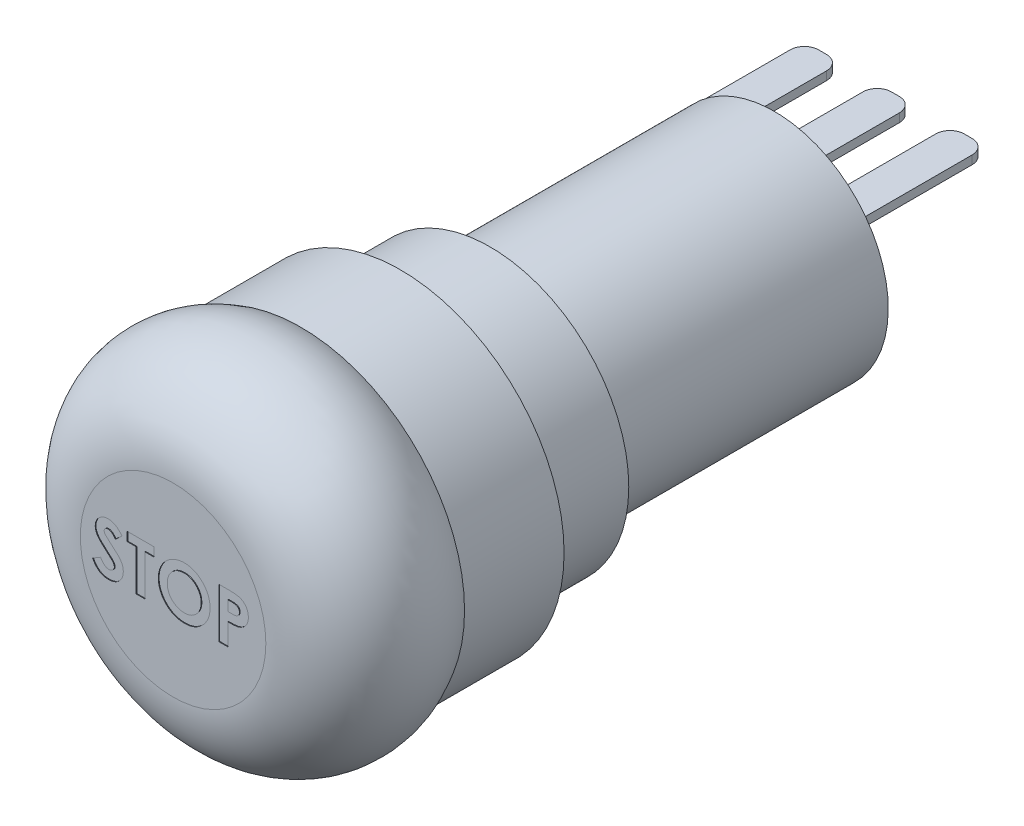
from build123d import *

# Parameters (mm, degrees)
ESQUISSE1_R             = 8
BOSS_EXTRU_1_DEPTH      = 20
ESQUISSE2_R             = 9.75
BOSS_EXTRU_2_DEPTH      = 6.3
ESQUISSE4_W             = 12.8
ESQUISSE4_H             = 0.6
BOSS_EXTRU_3_DEPTH      = 8.5
ENL_V_MAT_EXTRU_1_DEPTH = 0.05
ESQUISSE6_W             = 2.56
ESQUISSE6_H             = 8.5
ENL_V_MAT_EXTRU_2_DEPTH = 48.102123246
CONG_1_R                = 1


with BuildPart() as part:
    # Esquisse1 → Boss.-Extru.1 (new body)
    with BuildSketch(Plane.XY):
        Circle(ESQUISSE1_R)
    extrude(amount=BOSS_EXTRU_1_DEPTH)

    # Esquisse2 → Boss.-Extru.2 (add)
    with BuildSketch(Plane.XY.offset(20)):
        Circle(ESQUISSE2_R)
    extrude(amount=BOSS_EXTRU_2_DEPTH)

    # Esquisse3 → Révolution1 (revolve)
    with BuildSketch(Plane(origin=(0, 0, 0), x_dir=(1, 0, 0), z_dir=(0, 1, 0)), mode=Mode.PRIVATE) as r_volution1_sk:
        with BuildLine():
            Line((0, -26.3), (-11.5, -26.3))
            Line((-11.5, -26.3), (-11.5, -33.3))
            ThreePointArc((-11.5, -33.3), (-11.666697285, -39.267225633), (-6.524922359, -42.3))
            Line((-6.524922359, -42.3), (0, -42.3))
            Line((0, -42.3), (0, -26.3))
        make_face()
    revolve(r_volution1_sk.sketch.rotate(Axis((0, 0, 20), (0, 0, -1)), 180), axis=Axis((0, 0, 20), (0, 0, -1)))

    # Esquisse4 → Boss.-Extru.3 (add)
    with BuildSketch(Plane(origin=(0, 0, 0), x_dir=(-1, 0, 0), z_dir=(0, 0, -1))):
        with Locations((0, 4.5)):
            Rectangle(ESQUISSE4_W, ESQUISSE4_H)
    extrude(amount=BOSS_EXTRU_3_DEPTH)

    # Esquisse5 → Enlèv. mat.-Extru.1 (cut)
    # profile 1 of 4: a face of its own
    with BuildSketch(Plane.XY.offset(42.3)):
        with BuildLine():
            Line((-3.591313424, 1.492585178), (-4.061065026, 1.062797518))
            add(Edge.make_bspline(
                [(-4.061065026, 1.062797518), (-4.08118717, 1.091181894), (-4.119818882, 1.145675939), (-4.182436856, 1.21864475), (-4.244772078, 1.280892575), (-4.307402046, 1.332159373), (-4.370881887, 1.372133659), (-4.435101411, 1.400435896), (-4.499696539, 1.418427896), (-4.543094493, 1.420668333), (-4.564470475, 1.421771877)],
                knots=[0, 0, 0, 0, 1.299362458, 2.494594718, 3.587462134, 4.587049575, 5.512617175, 6.380583204, 7.202344345, 8, 8, 8, 8], degree=3))
            add(Edge.make_bspline(
                [(-4.564470475, 1.421771877), (-4.584409377, 1.421072621), (-4.62290616, 1.419722542), (-4.677786179, 1.406302853), (-4.726509442, 1.38314244), (-4.769028396, 1.352858253), (-4.802709681, 1.316372828), (-4.829601575, 1.278108998), (-4.844743971, 1.235874384), (-4.846737008, 1.206865947), (-4.84772368, 1.19250505)],
                knots=[0, 0, 0, 0, 1.185010067, 2.2879431, 3.333075148, 4.379039566, 5.372662701, 6.27520591, 7.14612461, 8, 8, 8, 8], degree=3))
            add(Edge.make_bspline(
                [(-4.84772368, 1.19250505), (-4.847105383, 1.177937062), (-4.845860218, 1.14859916), (-4.833833624, 1.10560081), (-4.815706113, 1.063586417), (-4.798384537, 1.038010257), (-4.789530571, 1.024936941)],
                knots=[0, 0, 0, 0, 0.967525499, 1.948461899, 2.951351359, 4, 4, 4, 4], degree=3))
            add(Edge.make_bspline(
                [(-4.789530571, 1.024936941), (-4.781481358, 1.014775189), (-4.762953134, 0.991384179), (-4.727623605, 0.954336465), (-4.683257136, 0.908949772), (-4.628146412, 0.856784816), (-4.564579232, 0.795965541), (-4.489609173, 0.728882776), (-4.405394202, 0.653459046), (-4.345536151, 0.600936691), (-4.314169994, 0.573414505)],
                knots=[0, 0, 0, 0, 0.473873513, 1.090794244, 1.870441696, 2.795289791, 3.865433203, 5.087734844, 6.473946851, 8, 8, 8, 8], degree=3))
            add(Edge.make_bspline(
                [(-4.314169994, 0.573414505), (-4.284728344, 0.547934242), (-4.228854208, 0.499577995), (-4.149356408, 0.430944068), (-4.079491082, 0.369195797), (-4.018240452, 0.315259892), (-3.966533017, 0.268570441), (-3.9241514, 0.22890427), (-3.89057798, 0.197033607), (-3.871493457, 0.177783706), (-3.86334868, 0.169568351)],
                knots=[0, 0, 0, 0, 1.543621617, 2.929473131, 4.163658386, 5.240097082, 6.164993805, 6.925417477, 7.541396219, 8, 8, 8, 8], degree=3))
            add(Edge.make_bspline(
                [(-3.86334868, 0.169568351), (-3.832449095, 0.136128383), (-3.773049243, 0.071845021), (-3.695850374, -0.027773974), (-3.632313208, -0.125022426), (-3.583159651, -0.221730222), (-3.546036908, -0.319292663), (-3.519864883, -0.420102463), (-3.504190282, -0.525213021), (-3.502450036, -0.596938145), (-3.501569834, -0.633216104)],
                knots=[0, 0, 0, 0, 1.206664779, 2.319633467, 3.337109185, 4.282041471, 5.190008762, 6.099243693, 7.03861361, 8, 8, 8, 8], degree=3))
            add(Edge.make_bspline(
                [(-3.501569834, -0.633216104), (-3.502196339, -0.668564525), (-3.503425566, -0.737919444), (-3.518481233, -0.839410036), (-3.539949732, -0.936540938), (-3.573143796, -1.028255227), (-3.613600526, -1.116058366), (-3.66431888, -1.198582662), (-3.723880631, -1.276663293), (-3.792147544, -1.348904473), (-3.867658856, -1.414458337), (-3.948651915, -1.472815935), (-4.035918711, -1.520997565), (-4.12871365, -1.560671701), (-4.226987063, -1.591229251), (-4.330621875, -1.613814128), (-4.439776602, -1.627369215), (-4.514418178, -1.628786239), (-4.552551404, -1.629510174)],
                knots=[0, 0, 0, 0, 1.043214005, 2.046824704, 3.02475056, 3.976699089, 4.921714032, 5.875962561, 6.831408892, 7.817874052, 8.806269674, 9.781291748, 10.760897367, 11.74438705, 12.757449933, 13.795994037, 14.874007457, 16, 16, 16, 16], degree=3))
            add(Edge.make_bspline(
                [(-4.552551404, -1.629510174), (-4.582485662, -1.628979121), (-4.64177266, -1.62792733), (-4.729152731, -1.619340333), (-4.813528068, -1.605481834), (-4.894803629, -1.585618465), (-4.973345574, -1.560448883), (-5.04915713, -1.529705202), (-5.121714944, -1.492910907), (-5.191568023, -1.450822635), (-5.258376795, -1.401952607), (-5.32298603, -1.347299956), (-5.384753968, -1.286024098), (-5.443977268, -1.218269949), (-5.500277002, -1.143845645), (-5.555496064, -1.063787682), (-5.607180352, -0.976610294), (-5.639108036, -0.915454651), (-5.655415988, -0.884217706)],
                knots=[0, 0, 0, 0, 1.016823716, 2.013894106, 2.979844003, 3.91962641, 4.853723003, 5.779685073, 6.695824784, 7.614987388, 8.547259901, 9.504950863, 10.487499108, 11.500346958, 12.559593716, 13.656357062, 14.802919212, 16, 16, 16, 16], degree=3))
            Line((-5.655415988, -0.884217706), (-5.102932013, -0.552587098))
            add(Edge.make_bspline(
                [(-5.102932013, -0.552587098), (-5.082533203, -0.588045111), (-5.043426939, -0.656021154), (-4.97715772, -0.747355583), (-4.909268288, -0.825568403), (-4.838189101, -0.889277197), (-4.764784454, -0.939333834), (-4.688699786, -0.975107779), (-4.609881642, -0.997251811), (-4.556194303, -0.999956109), (-4.529414385, -1.001305046)],
                knots=[0, 0, 0, 0, 1.283663364, 2.460892379, 3.537111102, 4.529833553, 5.449777664, 6.316464042, 7.160231139, 8, 8, 8, 8], degree=3))
            add(Edge.make_bspline(
                [(-4.529414385, -1.001305046), (-4.502175374, -1.000203431), (-4.449327726, -0.998066136), (-4.37389447, -0.978324589), (-4.304734406, -0.947328912), (-4.244952956, -0.903102354), (-4.194333794, -0.852058185), (-4.156973947, -0.795269213), (-4.133504239, -0.733824917), (-4.131022922, -0.691141666), (-4.129774962, -0.669674437)],
                knots=[0, 0, 0, 0, 1.13588714, 2.203786484, 3.234766741, 4.283437687, 5.291419208, 6.222934724, 7.106237994, 8, 8, 8, 8], degree=3))
            add(Edge.make_bspline(
                [(-4.129774962, -0.669674437), (-4.130927402, -0.649702674), (-4.133268474, -0.609131949), (-4.15051209, -0.548809804), (-4.177469121, -0.488515093), (-4.20936119, -0.43905974), (-4.241815363, -0.397652113), (-4.272848873, -0.361774277), (-4.310639479, -0.32213555), (-4.35509136, -0.278686069), (-4.405617191, -0.231043337), (-4.462259534, -0.179212019), (-4.525667003, -0.123648687), (-4.570483527, -0.085799494), (-4.59391759, -0.066008572)],
                knots=[0, 0, 0, 0, 0.916159276, 1.861089862, 2.860218735, 3.940849679, 4.552606315, 5.27541173, 6.11797699, 7.06649574, 8.129236253, 9.306560635, 10.591630461, 12, 12, 12, 12], degree=3))
            add(Edge.make_bspline(
                [(-4.59391759, -0.066008572), (-4.638466677, -0.028315773), (-4.723969857, 0.044028117), (-4.8447967, 0.150877765), (-4.953672504, 0.250738552), (-5.0496569, 0.344844975), (-5.133972879, 0.431459107), (-5.206049417, 0.51128446), (-5.265094719, 0.584936779), (-5.327227168, 0.672173022), (-5.386265416, 0.778476377), (-5.437291217, 0.906371638), (-5.470394603, 1.03425067), (-5.474103377, 1.120101609), (-5.475928808, 1.162356813)],
                knots=[0, 0, 0, 0, 1.345494975, 2.582412109, 3.71882943, 4.751509156, 5.681369928, 6.505683931, 7.230279997, 7.856715994, 8.973648664, 10.023341002, 11.027102913, 12, 12, 12, 12], degree=3))
            add(Edge.make_bspline(
                [(-5.475928808, 1.162356813), (-5.475169614, 1.192321935), (-5.473673919, 1.251356445), (-5.460332092, 1.33815809), (-5.440392222, 1.421914385), (-5.411433808, 1.502319747), (-5.373849282, 1.579273466), (-5.328204335, 1.653152263), (-5.273790189, 1.723276174), (-5.212469118, 1.789598712), (-5.144908999, 1.850209964), (-5.072712426, 1.903705468), (-4.996288038, 1.948888548), (-4.916103361, 1.986371193), (-4.831661524, 2.015061777), (-4.743584605, 2.035399094), (-4.651746275, 2.047495081), (-4.589279826, 2.04913939), (-4.557459257, 2.049977005)],
                knots=[0, 0, 0, 0, 1.010766082, 1.991317756, 2.957454644, 3.913069143, 4.869106762, 5.843196583, 6.838735724, 7.860187025, 8.887984031, 9.89767229, 10.887916223, 11.879572884, 12.879850636, 13.892031539, 14.926195476, 16, 16, 16, 16], degree=3))
            add(Edge.make_bspline(
                [(-4.557459257, 2.049977005), (-4.516221374, 2.048468435), (-4.434071126, 2.045463204), (-4.312609616, 2.021963279), (-4.19397109, 1.985007172), (-4.098369943, 1.940423694), (-4.022301895, 1.897235658), (-3.964002841, 1.857473554), (-3.904680416, 1.811923928), (-3.843856222, 1.760443239), (-3.782660465, 1.702061525), (-3.719353057, 1.638168607), (-3.65479664, 1.568212303), (-3.612845205, 1.518235843), (-3.591313424, 1.492585178)],
                knots=[0, 0, 0, 0, 1.282922637, 2.555718331, 3.837320111, 5.142675274, 5.830281639, 6.55870424, 7.337177975, 8.157850921, 9.037902056, 9.96903443, 10.957596896, 12, 12, 12, 12], degree=3))
        make_face()
    # profile 2 of 4: a face of its own
    with BuildSketch(Plane.XY.offset(42.3)):
        Polygon((-3.232339065, 1.960233415), (-1.34772368, 1.960233415), (-1.34772368, 1.332028287), (-1.975928808, 1.332028287), (-1.975928808, -1.539766585), (-2.604133936, -1.539766585), (-2.604133936, 1.332028287), (-3.232339065, 1.332028287), align=None)
    # profile 3 of 4: a face of its own
    with BuildSketch(Plane.XY.offset(42.3)):
        with BuildLine():
            add(Edge.make_bspline(
                [(0.790697794, 2.049977005), (0.851549584, 2.048401443), (0.971684799, 2.045290927), (1.148360348, 2.01936235), (1.318619907, 1.977115451), (1.482386484, 1.918389205), (1.639250028, 1.841593007), (1.789763848, 1.74890408), (1.933388811, 1.638572976), (2.068653163, 1.513173538), (2.19366182, 1.376807125), (2.301981894, 1.229984437), (2.39435328, 1.076509797), (2.470910931, 0.915971967), (2.529223833, 0.747259144), (2.570144407, 0.571231541), (2.596433849, 0.387939238), (2.59945754, 0.263142162), (2.600994269, 0.199716588)],
                knots=[0, 0, 0, 0, 1.014329547, 2.002516266, 2.970391464, 3.935626869, 4.897733899, 5.877609409, 6.878433252, 7.912639331, 8.949961323, 9.958554974, 10.949718813, 11.932905612, 12.9188844, 13.919928257, 14.942845884, 16, 16, 16, 16], degree=3))
            add(Edge.make_bspline(
                [(2.600994269, 0.199716588), (2.599357719, 0.137005675), (2.596132845, 0.013431808), (2.571217658, -0.168171385), (2.529607975, -0.342313365), (2.472284106, -0.509388307), (2.397114921, -0.668586955), (2.306544878, -0.820925773), (2.198184006, -0.964991018), (2.075984652, -1.100705381), (1.941453767, -1.223895286), (1.798964204, -1.332456178), (1.649173891, -1.42444658), (1.492302073, -1.499824358), (1.328012347, -1.558322275), (1.156710527, -1.599596806), (0.978407215, -1.624680172), (0.857152315, -1.627883982), (0.795605647, -1.629510174)],
                knots=[0, 0, 0, 0, 1.051557043, 2.072126891, 3.067553643, 4.050577992, 5.02905126, 6.015227836, 7.017913613, 8.04756643, 9.074058332, 10.072836633, 11.047628519, 12.017157415, 12.98668631, 13.966869689, 14.968021931, 16, 16, 16, 16], degree=3))
            add(Edge.make_bspline(
                [(0.795605647, -1.629510174), (0.731235212, -1.6280514), (0.604756105, -1.625185106), (0.419653366, -1.597927967), (0.242308948, -1.556869194), (0.074212646, -1.495591177), (-0.086347457, -1.418988503), (-0.238191679, -1.324647718), (-0.38126899, -1.212724727), (-0.514758675, -1.086085919), (-0.635700654, -0.947515287), (-0.742455673, -0.801127702), (-0.832505899, -0.648041438), (-0.905854628, -0.488184846), (-0.96367982, -0.322551396), (-1.004468922, -0.150132332), (-1.028564018, 0.028658821), (-1.031920325, 0.150097346), (-1.033621116, 0.211635659)],
                knots=[0, 0, 0, 0, 1.067978421, 2.098431617, 3.099715153, 4.085208694, 5.062210972, 6.048429807, 7.046490867, 8.072918869, 9.098532598, 10.095778865, 11.076610158, 12.041847152, 13.011192615, 13.984257998, 14.978533688, 16, 16, 16, 16], degree=3))
            add(Edge.make_bspline(
                [(-1.033621116, 0.211635659), (-1.03308731, 0.253035414), (-1.032026457, 0.33531071), (-1.019247368, 0.457238497), (-1.000849154, 0.576786418), (-0.973639068, 0.693477833), (-0.940585768, 0.808135946), (-0.89776055, 0.91969349), (-0.849013861, 1.029342207), (-0.792057945, 1.135787008), (-0.728728474, 1.238048513), (-0.659630383, 1.335644335), (-0.584589925, 1.427394399), (-0.503848831, 1.513901648), (-0.417128855, 1.594597464), (-0.32557071, 1.670624208), (-0.227398702, 1.73996234), (-0.124761506, 1.804305235), (-0.018237768, 1.8624894), (0.091738864, 1.91201402), (0.202902654, 1.955263028), (0.3167386, 1.989397057), (0.432026748, 2.017198867), (0.549998718, 2.035584681), (0.6695887, 2.048363416), (0.750232291, 2.049437866), (0.790697794, 2.049977005)],
                knots=[0, 0, 0, 0, 1.034744296, 2.056386356, 3.06226378, 4.057406941, 5.050368692, 6.043467995, 7.042652155, 8.049140477, 9.059438543, 10.048523776, 11.036952808, 12.020949711, 13.004946614, 13.997082645, 14.994316842, 16.007702937, 17.024872941, 18.026463647, 19.021641123, 20.005082605, 20.995858141, 21.984425357, 22.988620895, 24, 24, 24, 24], degree=3))
        make_face()
        with BuildLine():
            add(Edge.make_bspline(
                [(0.780882089, 1.421771877), (0.739928843, 1.420673009), (0.659103523, 1.418504284), (0.540547498, 1.401981535), (0.426729527, 1.375592825), (0.318280548, 1.337369102), (0.214730535, 1.288720003), (0.115895924, 1.229815516), (0.023145371, 1.158630862), (-0.064757864, 1.078987631), (-0.144163971, 0.990246767), (-0.214321772, 0.89514584), (-0.273032551, 0.793843667), (-0.322203197, 0.687281319), (-0.359217795, 0.574260533), (-0.385582183, 0.455666612), (-0.402243493, 0.331295214), (-0.404343672, 0.246511393), (-0.405415988, 0.203222197)],
                knots=[0, 0, 0, 0, 1.033739768, 2.040188636, 3.016340934, 3.979330865, 4.937572243, 5.900995986, 6.878200029, 7.884839167, 8.891893314, 9.879764717, 10.863503415, 11.843163062, 12.837761627, 13.859916423, 14.907309254, 16, 16, 16, 16], degree=3))
            add(Edge.make_bspline(
                [(-0.405415988, 0.203222197), (-0.40399426, 0.155248031), (-0.40120791, 0.061226614), (-0.381602813, -0.075929296), (-0.348060443, -0.205459441), (-0.299625913, -0.326730307), (-0.239554388, -0.441088517), (-0.164955089, -0.547132448), (-0.07703617, -0.645497043), (-0.009304148, -0.70292639), (0.025072794, -0.732074277)],
                knots=[0, 0, 0, 0, 1.078454662, 2.113592447, 3.107694534, 4.079536787, 5.043276885, 6.005368276, 6.987637804, 8, 8, 8, 8], degree=3))
            add(Edge.make_bspline(
                [(0.025072794, -0.732074277), (0.053234073, -0.753607616), (0.108922152, -0.796189146), (0.197812449, -0.85076611), (0.289351953, -0.897544014), (0.384231442, -0.935340006), (0.482250537, -0.965069699), (0.583395795, -0.985888913), (0.687523904, -0.998954771), (0.75794021, -1.000516389), (0.793502282, -1.001305046)],
                knots=[0, 0, 0, 0, 1.023928204, 2.024787132, 3.009472467, 3.9914905, 4.972207045, 5.96565515, 6.972602802, 8, 8, 8, 8], degree=3))
            add(Edge.make_bspline(
                [(0.793502282, -1.001305046), (0.833751336, -1.000196862), (0.912942616, -0.998016473), (1.029291656, -0.981697128), (1.140757571, -0.954078902), (1.24803235, -0.916190491), (1.35080666, -0.866930561), (1.448578215, -0.806199041), (1.541518436, -0.734741635), (1.629309683, -0.654052513), (1.709555032, -0.564962072), (1.779566428, -0.469353887), (1.840143917, -0.369334491), (1.888292058, -0.263488263), (1.926769019, -0.15281434), (1.952816099, -0.036822572), (1.969618158, 0.084008878), (1.971718929, 0.166238951), (1.972789141, 0.20813005)],
                knots=[0, 0, 0, 0, 1.026359118, 2.019393844, 2.989460624, 3.950973911, 4.916101784, 5.890408035, 6.881132271, 7.902007068, 8.92769091, 9.933912415, 10.920395702, 11.90457117, 12.894218921, 13.903490204, 14.931958862, 16, 16, 16, 16], degree=3))
            add(Edge.make_bspline(
                [(1.972789141, 0.20813005), (1.971681899, 0.249780264), (1.969502464, 0.331762358), (1.953154395, 0.452283152), (1.925711318, 0.56776285), (1.887709132, 0.678390043), (1.839182352, 0.784273186), (1.779174067, 0.885039932), (1.707894837, 0.980592864), (1.626985149, 1.070280825), (1.538919927, 1.152698317), (1.444373111, 1.224221717), (1.345990229, 1.286373278), (1.241513896, 1.335060302), (1.13308161, 1.37384915), (1.020031713, 1.402413814), (0.901936021, 1.418388211), (0.821593079, 1.420633935), (0.780882089, 1.421771877)],
                knots=[0, 0, 0, 0, 1.055025985, 2.07665775, 3.074803781, 4.057872707, 5.035505728, 6.020516407, 7.023567878, 8.050795229, 9.077271434, 10.074415901, 11.050397877, 12.019801805, 12.988065821, 13.964604439, 14.968634123, 16, 16, 16, 16], degree=3))
        make_face(mode=Mode.SUBTRACT)
    # profile 4 of 4: a face of its own
    with BuildSketch(Plane.XY.offset(42.3)):
        with BuildLine():
            Line((3.229199397, 1.960233415), (3.930321192, 1.960233415))
            add(Edge.make_bspline(
                [(3.930321192, 1.960233415), (3.97613158, 1.960028358), (4.064509422, 1.95963276), (4.191957542, 1.954835608), (4.309534672, 1.946238819), (4.4172138, 1.935614547), (4.51495065, 1.920719731), (4.60286762, 1.903643991), (4.680982953, 1.882840769), (4.750177516, 1.858147634), (4.812277401, 1.829035392), (4.871043922, 1.798028776), (4.925148948, 1.761023474), (4.977323323, 1.72200776), (5.024584149, 1.677254477), (5.069879839, 1.629742022), (5.111291996, 1.577586089), (5.14901251, 1.521418012), (5.183230828, 1.462275537), (5.21312624, 1.400052935), (5.237375724, 1.334651745), (5.257718026, 1.266495039), (5.274057161, 1.195585786), (5.284933009, 1.121487889), (5.292320432, 1.044718727), (5.292972271, 0.992469587), (5.293301961, 0.96604271)],
                knots=[0, 0, 0, 0, 1.698747864, 3.27724071, 4.728299578, 6.070144658, 7.288476769, 8.393259625, 9.389771311, 10.283485332, 11.113357557, 11.931608583, 12.74405601, 13.541433047, 14.344816069, 15.154114104, 15.974336324, 16.810834471, 17.661136416, 18.50621059, 19.367396281, 20.244825668, 21.142564693, 22.063065223, 23.020325768, 24, 24, 24, 24], degree=3))
            add(Edge.make_bspline(
                [(5.293301961, 0.96604271), (5.29282494, 0.936807286), (5.291887536, 0.879356085), (5.282697949, 0.795139672), (5.266999232, 0.714846947), (5.246481831, 0.637800788), (5.217871773, 0.565268773), (5.185186126, 0.495520268), (5.144972412, 0.430510806), (5.099021815, 0.369427197), (5.048838521, 0.311772802), (4.993231181, 0.259212284), (4.933259694, 0.211387338), (4.869271213, 0.167796756), (4.801025508, 0.128528469), (4.728571821, 0.093214772), (4.651415396, 0.062985107), (4.597685983, 0.047175237), (4.570445391, 0.039159697)],
                knots=[0, 0, 0, 0, 1.102006807, 2.165578795, 3.188629044, 4.184801286, 5.166646146, 6.124351954, 7.085497154, 8.042432466, 9.003981491, 9.963833307, 10.922997304, 11.89326795, 12.880200226, 13.889073926, 14.929769137, 16, 16, 16, 16], degree=3))
            add(Edge.make_bspline(
                [(4.570445391, 0.039159697), (4.55250317, 0.034695644), (4.513634541, 0.025025066), (4.449317638, 0.015207003), (4.375199159, 0.006179897), (4.291039432, -0.001577808), (4.196789936, -0.006851239), (4.09254193, -0.010969555), (3.97824817, -0.013963995), (3.898772809, -0.014070251), (3.857404525, -0.014125559)],
                knots=[0, 0, 0, 0, 0.618981996, 1.340914327, 2.176866532, 3.120127938, 4.170906482, 5.338178032, 6.614476169, 8, 8, 8, 8], degree=3))
            Line((3.857404525, -0.014125559), (3.857404525, -1.539766585))
            Line((3.857404525, -1.539766585), (3.229199397, -1.539766585))
            Line((3.229199397, -1.539766585), (3.229199397, 1.960233415))
        make_face()
        with BuildLine():
            Line((3.857404525, 0.614079569), (4.079660134, 0.614079569))
            add(Edge.make_bspline(
                [(4.079660134, 0.614079569), (4.120103051, 0.614336009), (4.194518619, 0.614807861), (4.296144007, 0.621631122), (4.377812123, 0.632051619), (4.442331451, 0.646997023), (4.493275572, 0.669678652), (4.537211686, 0.695917025), (4.574896814, 0.729094727), (4.607526587, 0.767005929), (4.633613108, 0.810567801), (4.651702751, 0.859071021), (4.663453428, 0.911496485), (4.664538712, 0.947981138), (4.665096833, 0.966743832)],
                knots=[0, 0, 0, 0, 1.8619151, 3.425951444, 4.686033666, 5.651700536, 6.461346321, 7.243864085, 7.999046032, 8.762387399, 9.539336099, 10.322741239, 11.137448474, 12, 12, 12, 12], degree=3))
            add(Edge.make_bspline(
                [(4.665096833, 0.966743832), (4.664544453, 0.983136554), (4.663472703, 1.014942375), (4.655599335, 1.060846064), (4.643051451, 1.103637772), (4.62487005, 1.142870595), (4.601365803, 1.178477872), (4.57270937, 1.210445575), (4.539268468, 1.239458319), (4.513450137, 1.254815208), (4.500333211, 1.262617229)],
                knots=[0, 0, 0, 0, 1.102301479, 2.1387299, 3.123554645, 4.094223062, 5.036071848, 5.982632524, 6.975082478, 8, 8, 8, 8], degree=3))
            add(Edge.make_bspline(
                [(4.500333211, 1.262617229), (4.489222418, 1.268236276), (4.465698591, 1.28013295), (4.425635233, 1.293963703), (4.379402731, 1.305631467), (4.326688961, 1.315315598), (4.267704215, 1.32283149), (4.202459017, 1.328579266), (4.130857351, 1.330890671), (4.081062677, 1.331638623), (4.055120871, 1.332028287)],
                knots=[0, 0, 0, 0, 0.656809284, 1.390599849, 2.23162475, 3.173112763, 4.218524733, 5.370385145, 6.63003504, 8, 8, 8, 8], degree=3))
            Line((4.055120871, 1.332028287), (3.857404525, 1.332028287))
            Line((3.857404525, 1.332028287), (3.857404525, 0.614079569))
        make_face(mode=Mode.SUBTRACT)
    extrude(amount=-ENL_V_MAT_EXTRU_1_DEPTH, mode=Mode.SUBTRACT)

    # Esquisse6 → Enlèv. mat.-Extru.2 (cut, through all)
    with BuildSketch(Plane.XZ.offset(-4.2)):
        with Locations((-2.56, -4.25)):
            Rectangle(ESQUISSE6_W, ESQUISSE6_H)
        with Locations((2.56, -4.25)):
            Rectangle(ESQUISSE6_W, ESQUISSE6_H)
    extrude(amount=-ENL_V_MAT_EXTRU_2_DEPTH, mode=Mode.SUBTRACT)

    # Congé1
    cong_1_edges = [part.edges().sort_by_distance(p)[0] for p in [
        (1.28, 4.5, -8.5),
        (3.84, 4.5, -8.5),
        (-3.84, 4.5, -8.5),
        (-1.28, 4.5, -8.5),
        (6.4, 4.5, -8.5),
        (-6.4, 4.5, -8.5),
    ]]
    fillet(cong_1_edges, radius=CONG_1_R)


solid = part.part
